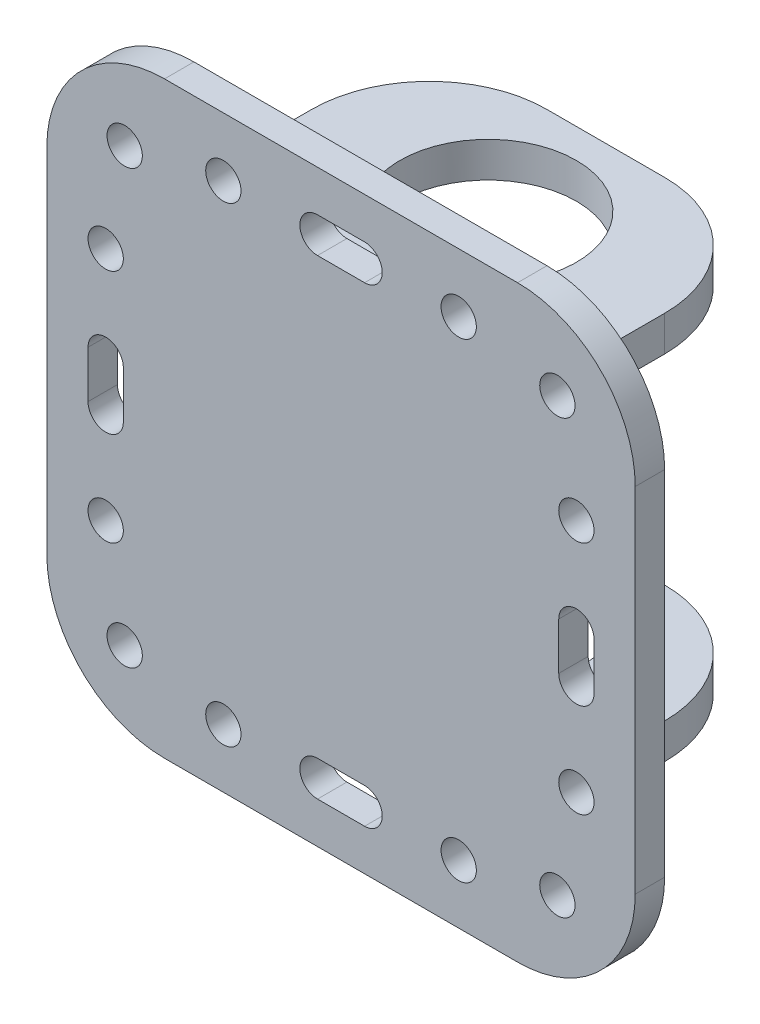
from build123d import *

# Parameters (mm, degrees)
SKETCH1_W           = 50
SKETCH1_H           = 50
BOSS_EXTRUDE1_DEPTH = 2.5
SKETCH2_R           = 1.5
CUT_EXTRUDE1_DEPTH  = 5
FILLET1_R           = 10
SKETCH3_W           = 30
SKETCH3_H           = 3
BOSS_EXTRUDE2_DEPTH = 20
SKETCH4_R           = 7.5
CUT_EXTRUDE2_DEPTH  = 53.414215629
FILLET2_R           = 10


with BuildPart() as part:
    # Sketch1 → Boss-Extrude1 (new body)
    with BuildSketch(Plane.XY):
        Rectangle(SKETCH1_W, SKETCH1_H)
    extrude(amount=BOSS_EXTRUDE1_DEPTH)

    # Sketch2 → Cut-Extrude1 (cut)
    with BuildSketch(Plane(origin=(0, 0, 0), x_dir=(-1, 0, 0), z_dir=(0, 0, -1))):
        with Locations((18.384776311, 18.384776311)):
            Circle(SKETCH2_R)
        with Locations((18.384776311, -18.384776311)):
            Circle(SKETCH2_R)
        with Locations((-18.384776311, -18.384776311)):
            Circle(SKETCH2_R)
        with Locations((-18.384776311, 18.384776311)):
            Circle(SKETCH2_R)
        with Locations((20, 10)):
            Circle(SKETCH2_R)
        with Locations((20, -10)):
            Circle(SKETCH2_R)
        with Locations((-20, -10)):
            Circle(SKETCH2_R)
        with Locations((-20, 10)):
            Circle(SKETCH2_R)
        with Locations((10, 20)):
            Circle(SKETCH2_R)
        with Locations((-10, 20)):
            Circle(SKETCH2_R)
        with Locations((10, -20)):
            Circle(SKETCH2_R)
        with Locations((-10, -20)):
            Circle(SKETCH2_R)
        with BuildLine():
            Line((-2, 21.5), (2, 21.5))
            ThreePointArc((2, 21.5), (3.5, 20), (2, 18.5))
            Line((2, 18.5), (-2, 18.5))
            ThreePointArc((-2, 18.5), (-3.5, 20), (-2, 21.5))
        make_face()
        with BuildLine():
            Line((21.5, 2), (21.5, -2))
            ThreePointArc((21.5, -2), (20, -3.5), (18.5, -2))
            Line((18.5, -2), (18.5, 2))
            ThreePointArc((18.5, 2), (20, 3.5), (21.5, 2))
        make_face()
        with BuildLine():
            Line((2, -21.5), (-2, -21.5))
            ThreePointArc((-2, -21.5), (-3.5, -20), (-2, -18.5))
            Line((-2, -18.5), (2, -18.5))
            ThreePointArc((2, -18.5), (3.5, -20), (2, -21.5))
        make_face()
        with BuildLine():
            Line((-21.5, -2), (-21.5, 2))
            ThreePointArc((-21.5, 2), (-20, 3.5), (-18.5, 2))
            Line((-18.5, 2), (-18.5, -2))
            ThreePointArc((-18.5, -2), (-20, -3.5), (-21.5, -2))
        make_face()
    extrude(amount=-CUT_EXTRUDE1_DEPTH, mode=Mode.SUBTRACT)

    # Fillet1
    fillet1_edges = [part.edges().sort_by_distance(p)[0] for p in [
        (25, -25, 1.25),
        (-25, -25, 1.25),
        (-25, 25, 1.25),
        (25, 25, 1.25),
    ]]
    fillet(fillet1_edges, radius=FILLET1_R)

    # Sketch3 → Boss-Extrude2 (add)
    with BuildSketch(Plane(origin=(0, 0, 0), x_dir=(-1, 0, 0), z_dir=(0, 0, -1))):
        with Locations((0, 15)):
            Rectangle(SKETCH3_W, SKETCH3_H)
        with Locations((0, -15)):
            Rectangle(SKETCH3_W, SKETCH3_H)
    extrude(amount=BOSS_EXTRUDE2_DEPTH)

    # Sketch4 → Cut-Extrude2 (cut, through all)
    with BuildSketch(Plane.XZ.offset(16.5)):
        with Locations(Location((0, -10, 0), (0, 0, 270))):
            Circle(SKETCH4_R)
    extrude(amount=-CUT_EXTRUDE2_DEPTH, mode=Mode.SUBTRACT)

    # Fillet2
    fillet2_edges = [part.edges().sort_by_distance(p)[0] for p in [
        (-15, 15, -20),
        (15, 15, -20),
        (15, -15, -20),
        (-15, -15, -20),
    ]]
    fillet(fillet2_edges, radius=FILLET2_R)


solid = part.part
